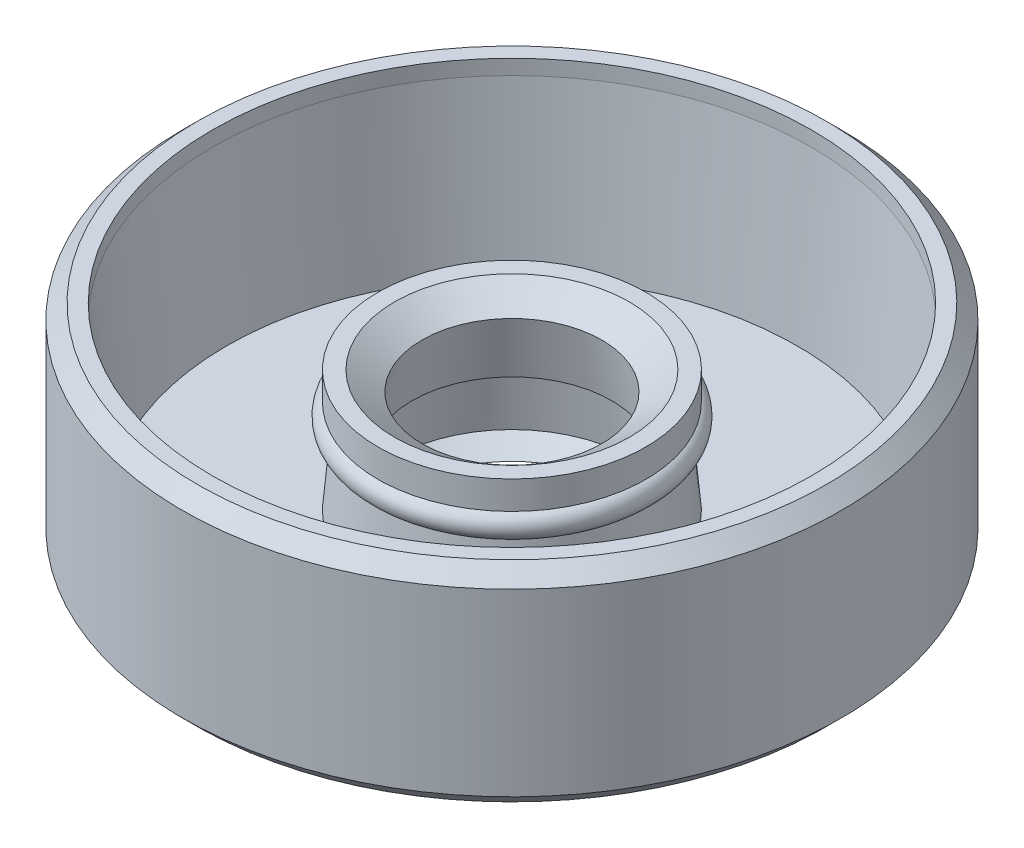
from build123d import *


with BuildPart() as part:
    # 草图1 → 旋转1 (revolve)
    with BuildSketch(Plane.XY):
        with BuildLine():
            Line((-10.5, 0), (-4.473202091, 0))
            Line((-4.473202091, 0), (-4.473202091, 0.5))
            Line((-4.473202091, 0.5), (-4.015036504, 0))
            Line((-4.015036504, 0), (-3.340059177, 0.059052864))
            Line((-3.340059177, 0.059052864), (-4.015036504, 0.5))
            Line((-4.015036504, 0.5), (-3.840059177, 2.5))
            Line((-3.840059177, 2.5), (-3.340059177, 2.5))
            Line((-3.340059177, 2.5), (-3, 4.428571429))
            Line((-3, 4.428571429), (-3.918095147, 5.071428571))
            Line((-3.918095147, 5.071428571), (-4.473202091, 5.071428571))
            Line((-4.473202091, 5.071428571), (-4.473202091, 4.133224056))
            ThreePointArc((-4.473202091, 4.133224056), (-4.708452271, 3.630475426), (-4.273202091, 3.286010461))
            Line((-4.273202091, 3.286010461), (-4.473202091, 1))
            Line((-4.473202091, 1), (-9.518812351, 1))
            Line((-9.518812351, 1), (-10, 6.5))
            Line((-10, 6.5), (-10, 7))
            Line((-10, 7), (-10.5, 7))
            Line((-10.5, 7), (-11, 6.5))
            Line((-11, 6.5), (-11, 0.5))
            Line((-11, 0.5), (-10.5, 0))
        make_face()
    revolve(axis=Axis((0, 5.977335763, 0), (0, -1, 0)))


solid = part.part
